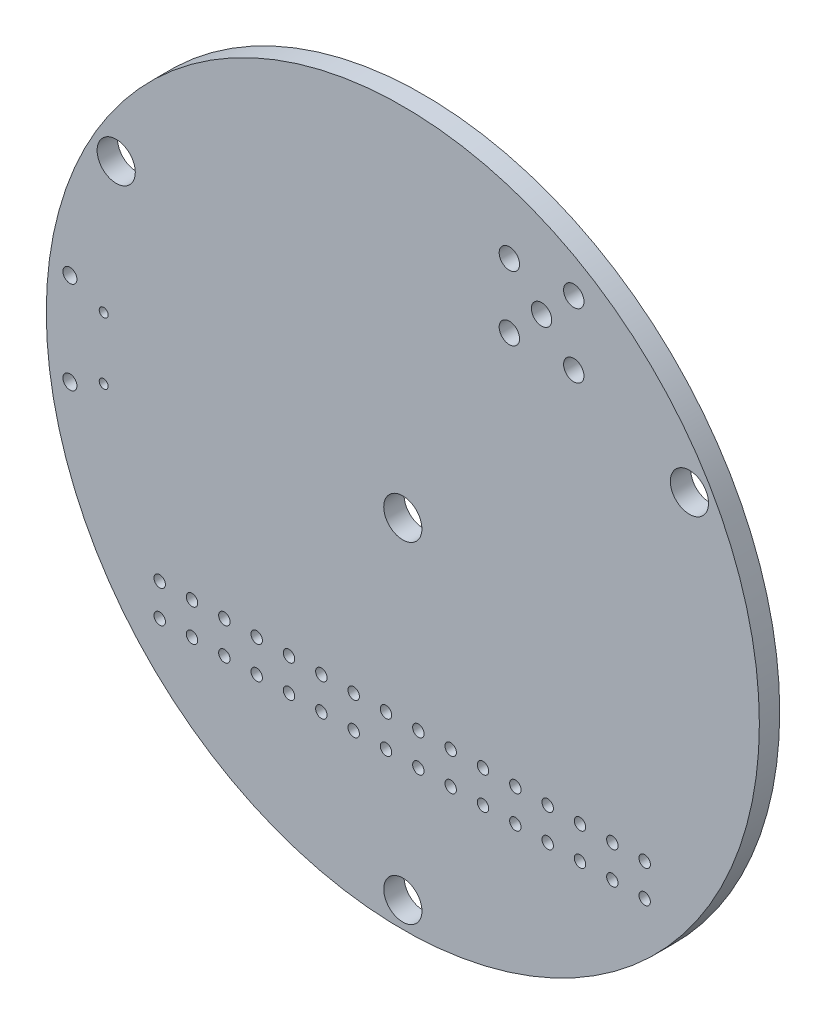
from build123d import *

# Parameters (mm, degrees)
SKETCH1_R           = 28.011018533
SKETCH1_R_2         = 0.7999984
SKETCH1_R_3         = 0.4499991
SKETCH1_R_4         = 1.49999954
SKETCH1_R_5         = 0.3499993
SKETCH1_R_6         = 0.5499989
BOSS_EXTRUDE1_DEPTH = 1.6
CUT_EXTRUDE1_REACH  = 84.056
SKETCH3_R           = 1.5


with BuildPart() as part:
    # Sketch1 → Boss-Extrude1 (new body)
    with BuildSketch(Plane.XY.offset(3.97256)):
        with Locations((29.99994, 29.99999842)):
            Circle(SKETCH1_R)
        with Locations(Location((43.4299995, 46.7699979, 0), (0, 0, 180))):
            Circle(SKETCH1_R_2, mode=Mode.SUBTRACT)
        with Locations(Location((46.4599401, 16.1399982, 0), (0, 0, 180))):
            Circle(SKETCH1_R_3, mode=Mode.SUBTRACT)
        with Locations(Location((43.4299995, 51.82999794, 0), (0, 0, 180))):
            Circle(SKETCH1_R_2, mode=Mode.SUBTRACT)
        with Locations(Location((43.9199401, 16.1399982, 0), (0, 0, 180))):
            Circle(SKETCH1_R_3, mode=Mode.SUBTRACT)
        with Locations(Location((48.9999401, 16.1399982, 0), (0, 0, 180))):
            Circle(SKETCH1_R_3, mode=Mode.SUBTRACT)
        with Locations(Location((41.3799401, 16.1399982, 0), (0, 0, 180))):
            Circle(SKETCH1_R_3, mode=Mode.SUBTRACT)
        with Locations(Location((38.36999946, 51.82999794, 0), (0, 0, 180))):
            Circle(SKETCH1_R_2, mode=Mode.SUBTRACT)
        with Locations(Location((40.89999948, 49.29999792, 0), (0, 0, 180))):
            Circle(SKETCH1_R_2, mode=Mode.SUBTRACT)
        with Locations(Location((38.36999946, 46.7699979, 0), (0, 0, 180))):
            Circle(SKETCH1_R_2, mode=Mode.SUBTRACT)
        with Locations(Location((38.8399401, 16.1399982, 0), (0, 0, 180))):
            Circle(SKETCH1_R_3, mode=Mode.SUBTRACT)
        with Locations(Location((31.2199401, 16.1399982, 0), (0, 0, 180))):
            Circle(SKETCH1_R_3, mode=Mode.SUBTRACT)
        with Locations(Location((41.3799401, 13.5999982, 0), (0, 0, 180))):
            Circle(SKETCH1_R_3, mode=Mode.SUBTRACT)
        with Locations(Location((43.9199401, 13.5999982, 0), (0, 0, 180))):
            Circle(SKETCH1_R_3, mode=Mode.SUBTRACT)
        with Locations(Location((38.8399401, 13.5999982, 0), (0, 0, 180))):
            Circle(SKETCH1_R_3, mode=Mode.SUBTRACT)
        with Locations(Location((48.9999401, 13.5999982, 0), (0, 0, 180))):
            Circle(SKETCH1_R_3, mode=Mode.SUBTRACT)
        with Locations(Location((46.4599401, 13.5999982, 0), (0, 0, 180))):
            Circle(SKETCH1_R_3, mode=Mode.SUBTRACT)
        with Locations(Location((36.2999401, 16.1399982, 0), (0, 0, 180))):
            Circle(SKETCH1_R_3, mode=Mode.SUBTRACT)
        with Locations(Location((36.2999401, 13.5999982, 0), (0, 0, 180))):
            Circle(SKETCH1_R_3, mode=Mode.SUBTRACT)
        with Locations(Location((33.7599401, 16.1399982, 0), (0, 0, 180))):
            Circle(SKETCH1_R_3, mode=Mode.SUBTRACT)
        with Locations(Location((33.7599401, 13.5999982, 0), (0, 0, 180))):
            Circle(SKETCH1_R_3, mode=Mode.SUBTRACT)
        with Locations(Location((31.2199401, 13.5999982, 0), (0, 0, 180))):
            Circle(SKETCH1_R_3, mode=Mode.SUBTRACT)
        with Locations(Location((29.99994, 29.99999842, 0), (0, 0, 180))):
            Circle(SKETCH1_R_4, mode=Mode.SUBTRACT)
        with Locations(Location((28.6799401, 16.1399982, 0), (0, 0, 180))):
            Circle(SKETCH1_R_3, mode=Mode.SUBTRACT)
        with Locations(Location((26.1399401, 16.1399982, 0), (0, 0, 180))):
            Circle(SKETCH1_R_3, mode=Mode.SUBTRACT)
        with Locations(Location((21.0599401, 16.1399982, 0), (0, 0, 180))):
            Circle(SKETCH1_R_3, mode=Mode.SUBTRACT)
        with Locations(Location((23.5999401, 16.1399982, 0), (0, 0, 180))):
            Circle(SKETCH1_R_3, mode=Mode.SUBTRACT)
        with Locations(Location((18.5199401, 16.1399982, 0), (0, 0, 180))):
            Circle(SKETCH1_R_3, mode=Mode.SUBTRACT)
        with Locations(Location((6.4999997, 32.22499778, 0), (0, 0, 180))):
            Circle(SKETCH1_R_5, mode=Mode.SUBTRACT)
        with Locations(Location((6.4999997, 27.37499986, 0), (0, 0, 180))):
            Circle(SKETCH1_R_5, mode=Mode.SUBTRACT)
        with Locations(Location((3.84999992, 33.42500046, 0), (0, 0, 180))):
            Circle(SKETCH1_R_6, mode=Mode.SUBTRACT)
        with Locations(Location((10.8999401, 16.1399982, 0), (0, 0, 180))):
            Circle(SKETCH1_R_3, mode=Mode.SUBTRACT)
        with Locations(Location((3.84999992, 26.17499718, 0), (0, 0, 180))):
            Circle(SKETCH1_R_6, mode=Mode.SUBTRACT)
        with Locations(Location((21.0599401, 13.5999982, 0), (0, 0, 180))):
            Circle(SKETCH1_R_3, mode=Mode.SUBTRACT)
        with Locations(Location((23.5999401, 13.5999982, 0), (0, 0, 180))):
            Circle(SKETCH1_R_3, mode=Mode.SUBTRACT)
        with Locations(Location((18.5199401, 13.5999982, 0), (0, 0, 180))):
            Circle(SKETCH1_R_3, mode=Mode.SUBTRACT)
        with Locations(Location((28.6799401, 13.5999982, 0), (0, 0, 180))):
            Circle(SKETCH1_R_3, mode=Mode.SUBTRACT)
        with Locations(Location((26.1399401, 13.5999982, 0), (0, 0, 180))):
            Circle(SKETCH1_R_3, mode=Mode.SUBTRACT)
        with Locations(Location((15.9799401, 16.1399982, 0), (0, 0, 180))):
            Circle(SKETCH1_R_3, mode=Mode.SUBTRACT)
        with Locations(Location((15.9799401, 13.5999982, 0), (0, 0, 180))):
            Circle(SKETCH1_R_3, mode=Mode.SUBTRACT)
        with Locations(Location((13.4399401, 16.1399982, 0), (0, 0, 180))):
            Circle(SKETCH1_R_3, mode=Mode.SUBTRACT)
        with Locations(Location((13.4399401, 13.5999982, 0), (0, 0, 180))):
            Circle(SKETCH1_R_3, mode=Mode.SUBTRACT)
        with Locations(Location((10.8999401, 13.5999982, 0), (0, 0, 180))):
            Circle(SKETCH1_R_3, mode=Mode.SUBTRACT)
    extrude(amount=-BOSS_EXTRUDE1_DEPTH)

    # Sketch3 → Cut-Extrude1 (cut, up to next)
    with BuildSketch(Plane.XY.offset(3.97256), mode=Mode.PRIVATE) as cut_extrude1_sk1:
        with Locations((7.483279502, 42.99999842)):
            Circle(SKETCH3_R)
    cut_extrude1_tool1 = extrude(cut_extrude1_sk1.sketch, amount=-CUT_EXTRUDE1_REACH, mode=Mode.PRIVATE) & part.part
    # Sketch3 → Cut-Extrude1 (cut, up to next)
    with BuildSketch(Plane.XY.offset(3.97256), mode=Mode.PRIVATE) as cut_extrude1_sk2:
        with Locations((52.516600498, 42.99999842)):
            Circle(SKETCH3_R)
    cut_extrude1_tool2 = extrude(cut_extrude1_sk2.sketch, amount=-CUT_EXTRUDE1_REACH, mode=Mode.PRIVATE) & part.part
    # Sketch3 → Cut-Extrude1 (cut, up to next)
    with BuildSketch(Plane.XY.offset(3.97256), mode=Mode.PRIVATE) as cut_extrude1_sk3:
        with Locations((29.99994, 3.99999842)):
            Circle(SKETCH3_R)
    cut_extrude1_tool3 = extrude(cut_extrude1_sk3.sketch, amount=-CUT_EXTRUDE1_REACH, mode=Mode.PRIVATE) & part.part
    add(cut_extrude1_tool1.solids().sort_by_distance((7.48328, 42.999998, 3.97256))[0], mode=Mode.SUBTRACT)
    add(cut_extrude1_tool2.solids().sort_by_distance((52.5166, 42.999998, 3.97256))[0], mode=Mode.SUBTRACT)
    add(cut_extrude1_tool3.solids().sort_by_distance((29.99994, 3.999998, 3.97256))[0], mode=Mode.SUBTRACT)


solid = part.part
